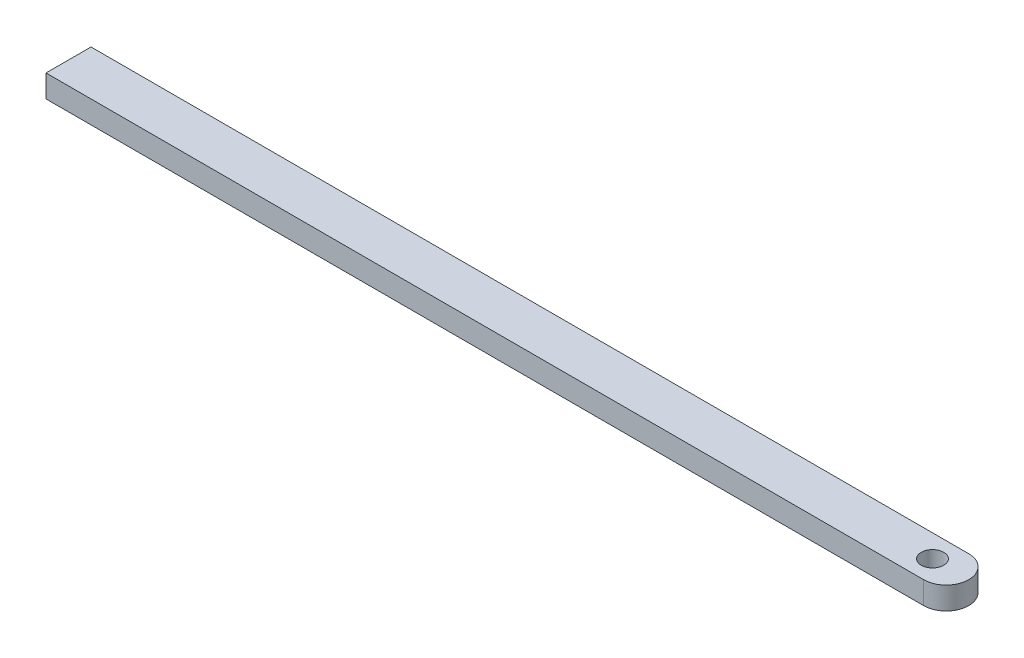
from build123d import *

# Parameters (mm, degrees)
SKETCH2_W           = 400
SKETCH2_H           = 20
SKETCH2_R           = 5
BOSS_EXTRUDE1_DEPTH = 10
FILLET1_RADIUS      = 10
FILLET1_LENGTH      = 10


with BuildPart() as part:
    # Sketch2 → Boss-Extrude1 (new body)
    with BuildSketch(Plane(origin=(0, 0, 0), x_dir=(1, 0, 0), z_dir=(0, 1, 0))):
        with Locations((89.044360902, -13.673273177)):
            Rectangle(SKETCH2_W, SKETCH2_H)
        with Locations(Location((272.933671002, -13.673273177, 0), (0, 0, 270))):
            Circle(SKETCH2_R, mode=Mode.SUBTRACT)
    extrude(amount=BOSS_EXTRUDE1_DEPTH)

    # Fillet1: full round fillet: the end face becomes a half cylinder, R = half its width
    fillet1_face = Plane((289.044360902, 5, 13.673273177), x_dir=(0, 1, 0), z_dir=(1, 0, 0))  # on the end face: x along it, z out of the body
    fillet1_slab = fillet1_face.offset(-FILLET1_RADIUS / 2) * Box(FILLET1_LENGTH, 2 * FILLET1_RADIUS, FILLET1_RADIUS, mode=Mode.PRIVATE)  # the body's end, R deep
    fillet1_round = Plane((279.044360902, 5, 13.673273177), x_dir=(1, 0, 0), z_dir=(0, 1, 0)) * Cylinder(FILLET1_RADIUS, FILLET1_LENGTH, mode=Mode.PRIVATE)  # its axis R under the face
    add(fillet1_slab - fillet1_round, mode=Mode.SUBTRACT)


solid = part.part
